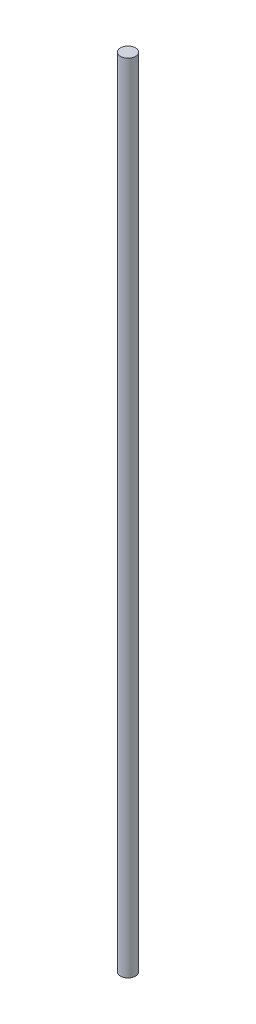
from build123d import *

# Parameters (mm, degrees)
SKETCH1_R           = 4.7625
BOSS_EXTRUDE1_DEPTH = 254


with BuildPart() as part:
    # Sketch1 → Boss-Extrude1 (new, symmetric)
    with BuildSketch(Plane(origin=(0, 0, 0), x_dir=(1, 0, 0), z_dir=(0, 1, 0))):
        with Locations(Location((0, 0, 0), (0, 0, 270))):
            Circle(SKETCH1_R)
    extrude(amount=BOSS_EXTRUDE1_DEPTH, both=True)


solid = part.part
